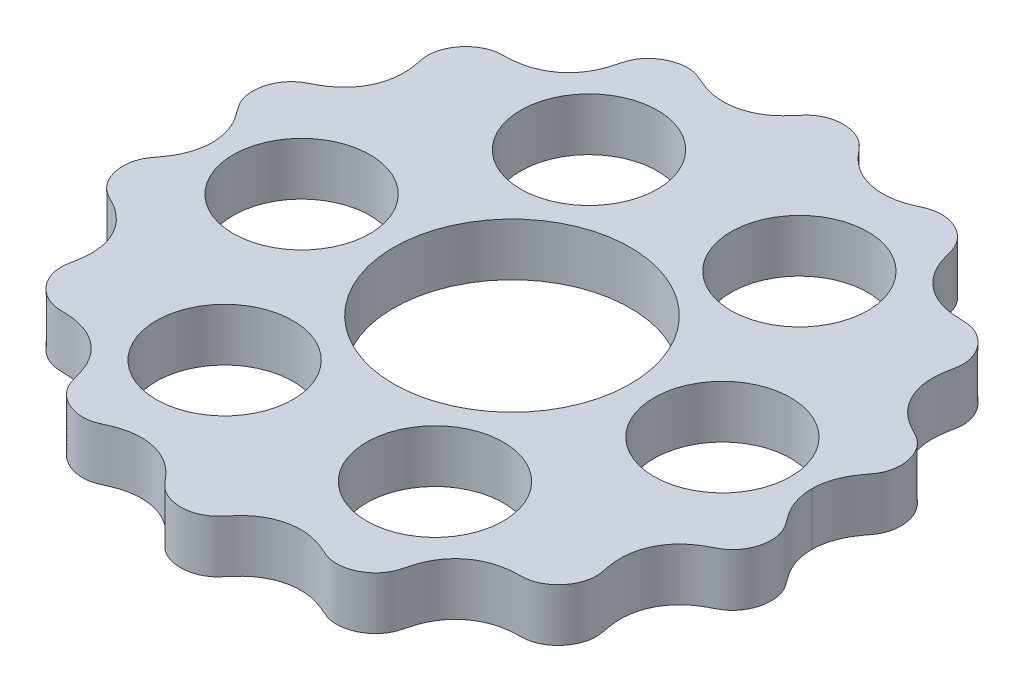
from build123d import *

# Parameters (mm, degrees)
SKETCH4_R           = 8.255
SKETCH4_R_2         = 14.2875
BOSS_EXTRUDE2_DEPTH = 6.35


with BuildPart() as part:
    # Sketch4 → Boss-Extrude2 (new body)
    with BuildSketch(Plane(origin=(0, 0, 0), x_dir=(1, 0, 0), z_dir=(0, 1, 0))):
        with BuildLine():
            add(Edge.make_bspline(
                [(36.195001508, 0), (36.195002158, -0.2828293), (36.225051228, -0.841087161), (36.358486104, -1.667606164), (36.704831698, -2.725717297), (37.159273778, -3.632552951), (37.615281068, -4.324548266), (38.000454646, -4.84132563), (38.330689442, -5.285265736), (38.63748253, -5.74737779), (38.945057755, -6.421891836), (39.144411566, -7.326831997), (39.147682752, -8.342817728), (38.907219569, -9.419675621), (38.477015194, -10.330342133), (37.926367198, -11.053800022), (37.379816965, -11.529532981), (36.922981396, -11.816228202), (36.527429999, -12.026968127), (36.209248234, -12.192685905), (35.73235006, -12.447955051), (35.110844583, -12.819042958), (34.380372555, -13.359152807), (33.60531612, -14.128262328), (32.948832781, -15.015410175), (32.43388292, -16.004773595), (32.079262744, -17.074524692), (31.897894732, -18.198222923), (31.892337393, -19.148294305), (31.970742053, -19.904802256), (32.063946909, -20.469820482), (32.136051972, -20.848955761), (32.228923536, -21.321700538), (32.316643476, -21.894892573), (32.307424281, -22.66559537), (32.086690731, -23.599888183), (31.629331684, -24.541830042), (30.916729448, -25.422127449), (30.100306608, -26.059111749), (29.254861724, -26.463289628), (28.525130508, -26.634585443), (27.965972858, -26.675759538), (27.406888223, -26.69332365), (26.75575277, -26.717194299), (25.922159102, -26.80044081), (24.921707206, -27.024693857), (23.880107532, -27.430196909), (22.917048402, -27.992031415), (22.057139836, -28.696759734), (21.320621345, -29.525350682), (20.722220719, -30.454581727), (20.34351195, -31.292464461), (20.111013106, -31.987093454), (19.963958099, -32.514145076), (19.871892736, -32.865003369), (19.755307612, -33.302807591), (19.583592519, -33.82023863), (19.247336729, -34.471496635), (18.665556941, -35.183980175), (17.873008777, -35.816585583), (16.877045892, -36.29830707), (15.891874324, -36.526824589), (14.977533609, -36.542467536), (14.261746738, -36.405609994), (13.751442465, -36.222206347), (13.338301581, -36.042285363), (13.008489954, -35.896141417), (12.508173276, -35.682417822), (11.825335009, -35.429432767), (10.940860128, -35.199022479), (9.848731703, -35.07997394), (8.742794043, -35.129520527), (7.650113069, -35.353687581), (6.599129122, -35.751453104), (5.617451817, -36.314538051), (4.879178325, -36.903875607), (4.342265733, -37.436481022), (3.962134672, -37.860538497), (3.712393706, -38.152056394), (3.40210195, -38.517267451), (3.007666977, -38.938219097), (2.399056726, -39.404169197), (1.533646591, -39.80706201), (0.513821853, -40.032130975), (-0.618710753, -40.020035479), (-1.627499692, -39.77419702), (-2.473305228, -39.358095507), (-3.061889497, -38.886964031), (-3.442004582, -38.47058468), (-3.806123826, -38.041760916), (-4.234333805, -37.545722188), (-4.825450304, -36.945322692), (-5.633191274, -36.304386233), (-6.609474123, -35.747130696), (-7.655595775, -35.352452217), (-8.744655654, -35.129444113), (-9.848734183, -35.079969237), (-10.940858278, -35.199025988), (-11.825336187, -35.429430527), (-12.508172628, -35.682419052), (-13.008490278, -35.896140798), (-13.33830141, -36.042285685), (-13.751442545, -36.222206193), (-14.261746693, -36.405610076), (-14.977533633, -36.542467487), (-15.891874307, -36.52682462), (-16.877045901, -36.298307052), (-17.873008769, -35.816585596), (-18.665556944, -35.183980167), (-19.247336725, -34.471496641), (-19.583592519, -33.820238627), (-19.75530761, -33.302807594), (-19.871892736, -32.865003368), (-19.963958098, -32.514145077), (-20.111013105, -31.987093454), (-20.343511948, -31.292464462), (-20.722220718, -30.454581728), (-21.320621344, -29.525350683), (-22.057139835, -28.696759735), (-22.917048401, -27.992031416), (-23.880107531, -27.43019691), (-24.921707205, -27.024693858), (-25.922159101, -26.800440811), (-26.755752769, -26.7171943), (-27.406888222, -26.693323651), (-27.965972857, -26.675759539), (-28.525130507, -26.634585444), (-29.254861723, -26.463289629), (-30.100306607, -26.05911175), (-30.916729447, -25.42212745), (-31.629331683, -24.541830043), (-32.08669073, -23.599888184), (-32.30742428, -22.665595371), (-32.316643475, -21.894892574), (-32.228923535, -21.321700539), (-32.136051971, -20.848955762), (-32.063946908, -20.469820483), (-31.970742052, -19.904802257), (-31.892337392, -19.148294306), (-31.897894731, -18.198222924), (-32.079262743, -17.074524693), (-32.433882919, -16.004773596), (-32.948832781, -15.015410176), (-33.60531612, -14.12826233), (-34.380372555, -13.359152808), (-35.110844583, -12.819042959), (-35.732350059, -12.447955052), (-36.209248234, -12.192685907), (-36.527429998, -12.026968128), (-36.922981395, -11.816228203), (-37.379816964, -11.529532982), (-37.926367198, -11.053800023), (-38.477015192, -10.330342133), (-38.90721957, -9.419675623), (-39.147682749, -8.342817728), (-39.144411569, -7.326832), (-38.945057748, -6.421891834), (-38.63748254, -5.747377797), (-38.330689423, -5.285265728), (-38.000454683, -4.841325651), (-37.615280986, -4.324548225), (-37.15927392, -3.632553027), (-36.704831489, -2.725717189), (-36.358486403, -1.667606313), (-36.225050948, -0.841086993), (-36.195002155, -0.282829265), (-36.195001595, 0)],
                knots=[0.11248595, 0.11248595, 0.11248595, 0.11248595, 0.11248595, 0.119002915, 0.125349267, 0.131695618, 0.13804197, 0.142293366, 0.144419064, 0.146544762, 0.150796158, 0.155047555, 0.161391313, 0.167735072, 0.174002303, 0.180269534, 0.184401794, 0.188534053, 0.190600183, 0.192666313, 0.194732443, 0.196798573, 0.20306507, 0.209331567, 0.215598064, 0.221864561, 0.228394153, 0.234923746, 0.241453338, 0.24798293, 0.25020499, 0.25242705, 0.25464911, 0.25687117, 0.261315289, 0.265759409, 0.272285186, 0.278810963, 0.285223385, 0.291635807, 0.295934165, 0.300232523, 0.302381702, 0.304530881, 0.308829239, 0.31524271, 0.321656182, 0.328069653, 0.334483125, 0.34082541, 0.347167696, 0.353509982, 0.359852268, 0.361941201, 0.364030134, 0.366119067, 0.368208, 0.372385866, 0.376563732, 0.382904378, 0.389245024, 0.395548664, 0.401852304, 0.40600733, 0.410162356, 0.412239869, 0.414317382, 0.416394895, 0.418472408, 0.424776943, 0.431081477, 0.437386012, 0.443690546, 0.450183026, 0.456675507, 0.463167987, 0.469660468, 0.471870691, 0.474080914, 0.476291137, 0.47850136, 0.482921807, 0.487342253, 0.493831581, 0.500320909, 0.506769961, 0.513219012, 0.517541995, 0.521864978, 0.52402647, 0.526187961, 0.530510944, 0.536960571, 0.543410199, 0.549859827, 0.556309454, 0.562613988, 0.568918523, 0.575223057, 0.581527592, 0.583605105, 0.585682618, 0.587760131, 0.589837644, 0.59399267, 0.598147696, 0.604451336, 0.610754976, 0.617095622, 0.623436268, 0.627614134, 0.631792, 0.633880933, 0.635969866, 0.638058799, 0.640147732, 0.646490018, 0.652832304, 0.65917459, 0.665516875, 0.671930347, 0.678343818, 0.68475729, 0.691170761, 0.695469119, 0.697618298, 0.699767477, 0.704065835, 0.708364193, 0.714776615, 0.721189037, 0.727714814, 0.734240591, 0.738684711, 0.74312883, 0.74535089, 0.74757295, 0.74979501, 0.75201707, 0.758546662, 0.765076254, 0.771605847, 0.778135439, 0.784401936, 0.790668433, 0.79693493, 0.803201427, 0.805267557, 0.807333687, 0.809399817, 0.811465947, 0.815598206, 0.819730466, 0.825997697, 0.832264928, 0.838608687, 0.844952445, 0.849203842, 0.853455238, 0.855580936, 0.857706634, 0.86195803, 0.868304382, 0.874650733, 0.880997085, 0.88751405, 0.88751405, 0.88751405, 0.88751405, 0.88751405], degree=4))
            add(Edge.make_bspline(
                [(36.195001508, 0), (36.195002158, 0.2828293), (36.225051228, 0.841087161), (36.358486104, 1.667606164), (36.704831698, 2.725717297), (37.159273778, 3.632552951), (37.615281068, 4.324548266), (38.000454646, 4.84132563), (38.330689442, 5.285265736), (38.63748253, 5.74737779), (38.945057755, 6.421891836), (39.144411566, 7.326831997), (39.147682752, 8.342817728), (38.907219569, 9.419675621), (38.477015194, 10.330342133), (37.926367198, 11.053800022), (37.379816965, 11.529532981), (36.922981396, 11.816228202), (36.527429999, 12.026968127), (36.209248234, 12.192685905), (35.73235006, 12.447955051), (35.110844583, 12.819042958), (34.380372555, 13.359152807), (33.60531612, 14.128262328), (32.948832781, 15.015410175), (32.43388292, 16.004773595), (32.079262744, 17.074524692), (31.897894732, 18.198222923), (31.892337393, 19.148294305), (31.970742053, 19.904802256), (32.063946909, 20.469820482), (32.136051972, 20.848955761), (32.228923536, 21.321700538), (32.316643476, 21.894892573), (32.307424281, 22.66559537), (32.086690731, 23.599888183), (31.629331684, 24.541830042), (30.916729448, 25.422127449), (30.100306608, 26.059111749), (29.254861724, 26.463289628), (28.525130508, 26.634585443), (27.965972858, 26.675759538), (27.406888223, 26.69332365), (26.75575277, 26.717194299), (25.922159102, 26.80044081), (24.921707206, 27.024693857), (23.880107532, 27.430196909), (22.917048402, 27.992031415), (22.057139836, 28.696759734), (21.320621345, 29.525350682), (20.722220719, 30.454581727), (20.34351195, 31.292464461), (20.111013106, 31.987093454), (19.963958099, 32.514145076), (19.871892736, 32.865003369), (19.755307612, 33.302807591), (19.583592519, 33.82023863), (19.247336729, 34.471496635), (18.665556941, 35.183980175), (17.873008777, 35.816585583), (16.877045892, 36.29830707), (15.891874324, 36.526824589), (14.977533609, 36.542467536), (14.261746737, 36.405609994), (13.751442465, 36.222206347), (13.338301581, 36.042285363), (13.008489954, 35.896141417), (12.508173276, 35.682417822), (11.825335009, 35.429432768), (10.940860128, 35.199022479), (9.848731703, 35.07997394), (8.742794043, 35.129520527), (7.650113069, 35.353687581), (6.599129122, 35.751453104), (5.617451817, 36.314538051), (4.879178325, 36.903875607), (4.342265733, 37.436481022), (3.962134672, 37.860538497), (3.712393706, 38.152056394), (3.40210195, 38.517267451), (3.007666977, 38.938219097), (2.399056726, 39.404169197), (1.533646591, 39.80706201), (0.513821853, 40.032130975), (-0.618710753, 40.020035479), (-1.627499692, 39.77419702), (-2.473305228, 39.358095507), (-3.061889497, 38.886964031), (-3.442004582, 38.47058468), (-3.806123826, 38.041760916), (-4.234333805, 37.545722188), (-4.825450304, 36.945322692), (-5.633191274, 36.304386233), (-6.609474123, 35.747130696), (-7.655595775, 35.352452217), (-8.744655654, 35.129444113), (-9.848734183, 35.079969237), (-10.940858278, 35.199025988), (-11.825336187, 35.429430527), (-12.508172628, 35.682419052), (-13.008490278, 35.896140798), (-13.33830141, 36.042285685), (-13.751442545, 36.222206193), (-14.261746693, 36.405610076), (-14.977533633, 36.542467487), (-15.891874307, 36.52682462), (-16.877045901, 36.298307052), (-17.873008769, 35.816585596), (-18.665556944, 35.183980167), (-19.247336725, 34.471496641), (-19.583592519, 33.820238627), (-19.75530761, 33.302807594), (-19.871892736, 32.865003368), (-19.963958098, 32.514145077), (-20.111013105, 31.987093454), (-20.343511949, 31.292464462), (-20.722220718, 30.454581728), (-21.320621344, 29.525350683), (-22.057139835, 28.696759735), (-22.917048401, 27.992031416), (-23.880107531, 27.43019691), (-24.921707205, 27.024693858), (-25.922159101, 26.800440811), (-26.755752769, 26.7171943), (-27.406888222, 26.693323651), (-27.965972857, 26.675759539), (-28.525130507, 26.634585444), (-29.254861723, 26.463289629), (-30.100306607, 26.05911175), (-30.916729447, 25.42212745), (-31.629331683, 24.541830043), (-32.08669073, 23.599888184), (-32.30742428, 22.665595371), (-32.316643475, 21.894892574), (-32.228923535, 21.321700539), (-32.136051971, 20.848955762), (-32.063946908, 20.469820483), (-31.970742052, 19.904802257), (-31.892337392, 19.148294306), (-31.897894731, 18.198222924), (-32.079262743, 17.074524693), (-32.433882919, 16.004773596), (-32.948832781, 15.015410176), (-33.60531612, 14.12826233), (-34.380372555, 13.359152808), (-35.110844583, 12.819042959), (-35.732350059, 12.447955052), (-36.209248234, 12.192685907), (-36.527429998, 12.026968128), (-36.922981395, 11.816228203), (-37.379816964, 11.529532982), (-37.926367198, 11.053800023), (-38.477015192, 10.330342133), (-38.90721957, 9.419675623), (-39.147682749, 8.342817728), (-39.144411569, 7.326832), (-38.945057748, 6.421891834), (-38.63748254, 5.747377797), (-38.330689423, 5.285265728), (-38.000454683, 4.841325651), (-37.615280986, 4.324548225), (-37.15927392, 3.632553027), (-36.704831489, 2.725717189), (-36.358486403, 1.667606313), (-36.225050948, 0.841086993), (-36.195002155, 0.282829265), (-36.195001595, 0)],
                knots=[0.11248595, 0.11248595, 0.11248595, 0.11248595, 0.11248595, 0.119002915, 0.125349267, 0.131695618, 0.13804197, 0.142293366, 0.144419064, 0.146544762, 0.150796158, 0.155047555, 0.161391313, 0.167735072, 0.174002303, 0.180269534, 0.184401794, 0.188534053, 0.190600183, 0.192666313, 0.194732443, 0.196798573, 0.20306507, 0.209331567, 0.215598064, 0.221864561, 0.228394153, 0.234923746, 0.241453338, 0.24798293, 0.25020499, 0.25242705, 0.25464911, 0.25687117, 0.261315289, 0.265759409, 0.272285186, 0.278810963, 0.285223385, 0.291635807, 0.295934165, 0.300232523, 0.302381702, 0.304530881, 0.308829239, 0.31524271, 0.321656182, 0.328069653, 0.334483125, 0.34082541, 0.347167696, 0.353509982, 0.359852268, 0.361941201, 0.364030134, 0.366119067, 0.368208, 0.372385866, 0.376563732, 0.382904378, 0.389245024, 0.395548664, 0.401852304, 0.40600733, 0.410162356, 0.412239869, 0.414317382, 0.416394895, 0.418472408, 0.424776943, 0.431081477, 0.437386012, 0.443690546, 0.450183026, 0.456675507, 0.463167987, 0.469660468, 0.471870691, 0.474080914, 0.476291137, 0.47850136, 0.482921807, 0.487342253, 0.493831581, 0.500320909, 0.506769961, 0.513219012, 0.517541995, 0.521864978, 0.52402647, 0.526187961, 0.530510944, 0.536960571, 0.543410199, 0.549859827, 0.556309454, 0.562613988, 0.568918523, 0.575223057, 0.581527592, 0.583605105, 0.585682618, 0.587760131, 0.589837644, 0.59399267, 0.598147696, 0.604451336, 0.610754976, 0.617095622, 0.623436268, 0.627614134, 0.631792, 0.633880933, 0.635969866, 0.638058799, 0.640147732, 0.646490018, 0.652832304, 0.65917459, 0.665516875, 0.671930347, 0.678343818, 0.68475729, 0.691170761, 0.695469119, 0.697618298, 0.699767477, 0.704065835, 0.708364193, 0.714776615, 0.721189037, 0.727714814, 0.734240591, 0.738684711, 0.74312883, 0.74535089, 0.74757295, 0.74979501, 0.75201707, 0.758546662, 0.765076254, 0.771605847, 0.778135439, 0.784401936, 0.790668433, 0.79693493, 0.803201427, 0.805267557, 0.807333687, 0.809399817, 0.811465947, 0.815598206, 0.819730466, 0.825997697, 0.832264928, 0.838608687, 0.844952445, 0.849203842, 0.853455238, 0.855580936, 0.857706634, 0.86195803, 0.868304382, 0.874650733, 0.880997085, 0.88751405, 0.88751405, 0.88751405, 0.88751405, 0.88751405], degree=4))
        make_face()
        with Locations(Location((-25.4, 0, 0), (0, 0, 270))):
            Circle(SKETCH4_R, mode=Mode.SUBTRACT)
        with Locations(Location((-12.7, 21.997045256, 0), (0, 0, 270))):
            Circle(SKETCH4_R, mode=Mode.SUBTRACT)
        with Locations(Location((12.7, 21.997045256, 0), (0, 0, 270))):
            Circle(SKETCH4_R, mode=Mode.SUBTRACT)
        with Locations(Location((25.4, 0, 0), (0, 0, 270))):
            Circle(SKETCH4_R, mode=Mode.SUBTRACT)
        with Locations(Location((12.7, -21.997045256, 0), (0, 0, 270))):
            Circle(SKETCH4_R, mode=Mode.SUBTRACT)
        with Locations(Location((-12.7, -21.997045256, 0), (0, 0, 270))):
            Circle(SKETCH4_R, mode=Mode.SUBTRACT)
        with Locations(Location((0, 0, 0), (0, 0, 270))):
            Circle(SKETCH4_R_2, mode=Mode.SUBTRACT)
    extrude(amount=BOSS_EXTRUDE2_DEPTH)


solid = part.part
